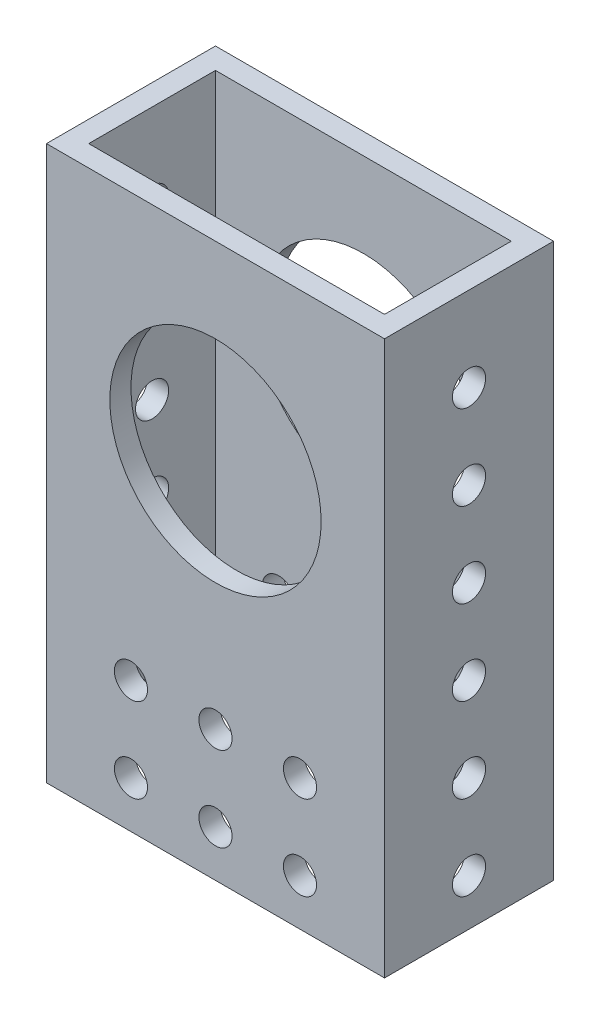
from build123d import *

# Parameters (mm, degrees)
SKETCH1_W           = 50.8
SKETCH1_H           = 225.425
SKETCH1_R           = 15.875
SKETCH1_R_2         = 2.4892
BOSS_EXTRUDE1_DEPTH = 25.4
SKETCH2_R           = 2.4892
CUT_EXTRUDE1_DEPTH  = 233.469848851
SKETCH3_W           = 44.45
SKETCH3_H           = 19.05
CUT_EXTRUDE2_DEPTH  = 233.469848884
SKETCH4_W           = 50.8
SKETCH4_H           = 142.24
CUT_EXTRUDE3_DEPTH  = 233.469848851


with BuildPart() as part:
    # Sketch1 → Boss-Extrude1 (new body)
    with BuildSketch(Plane.XY):
        with Locations((25.4, 112.7125)):
            Rectangle(SKETCH1_W, SKETCH1_H)
        with Locations((25.4, 196.85)):
            Circle(SKETCH1_R, mode=Mode.SUBTRACT)
        with Locations((25.4, 9.525)):
            Circle(SKETCH1_R_2, mode=Mode.SUBTRACT)
        with Locations((38.1, 9.525)):
            Circle(SKETCH1_R_2, mode=Mode.SUBTRACT)
        with Locations((12.7, 9.525)):
            Circle(SKETCH1_R_2, mode=Mode.SUBTRACT)
        with Locations((12.7, 22.225)):
            Circle(SKETCH1_R_2, mode=Mode.SUBTRACT)
        with Locations((25.4, 22.225)):
            Circle(SKETCH1_R_2, mode=Mode.SUBTRACT)
        with Locations((38.1, 22.225)):
            Circle(SKETCH1_R_2, mode=Mode.SUBTRACT)
        with Locations((12.7, 34.925)):
            Circle(SKETCH1_R_2, mode=Mode.SUBTRACT)
        with Locations((25.4, 34.925)):
            Circle(SKETCH1_R_2, mode=Mode.SUBTRACT)
        with Locations((38.1, 34.925)):
            Circle(SKETCH1_R_2, mode=Mode.SUBTRACT)
        with Locations((12.7, 85.725)):
            Circle(SKETCH1_R_2, mode=Mode.SUBTRACT)
        with Locations((25.4, 85.725)):
            Circle(SKETCH1_R_2, mode=Mode.SUBTRACT)
        with Locations((38.1, 85.725)):
            Circle(SKETCH1_R_2, mode=Mode.SUBTRACT)
        with Locations((12.7, 98.425)):
            Circle(SKETCH1_R_2, mode=Mode.SUBTRACT)
        with Locations((25.4, 98.425)):
            Circle(SKETCH1_R_2, mode=Mode.SUBTRACT)
        with Locations((38.1, 98.425)):
            Circle(SKETCH1_R_2, mode=Mode.SUBTRACT)
        with Locations((12.7, 149.225)):
            Circle(SKETCH1_R_2, mode=Mode.SUBTRACT)
        with Locations((25.4, 149.225)):
            Circle(SKETCH1_R_2, mode=Mode.SUBTRACT)
        with Locations((38.1, 149.225)):
            Circle(SKETCH1_R_2, mode=Mode.SUBTRACT)
        with Locations((12.7, 161.925)):
            Circle(SKETCH1_R_2, mode=Mode.SUBTRACT)
        with Locations((25.4, 161.925)):
            Circle(SKETCH1_R_2, mode=Mode.SUBTRACT)
        with Locations((38.1, 161.925)):
            Circle(SKETCH1_R_2, mode=Mode.SUBTRACT)
    extrude(amount=BOSS_EXTRUDE1_DEPTH)

    # Sketch2 → Cut-Extrude1 (cut, through all)
    with BuildSketch(Plane(origin=(50.8, 0, 0), x_dir=(0, 0, -1), z_dir=(1, 0, 0))):
        with Locations((-12.7, 9.525)):
            Circle(SKETCH2_R)
        with Locations((-12.7, 22.225)):
            Circle(SKETCH2_R)
        with Locations((-12.7, 34.925)):
            Circle(SKETCH2_R)
        with Locations((-12.7, 47.625)):
            Circle(SKETCH2_R)
        with Locations((-12.7, 60.325)):
            Circle(SKETCH2_R)
        with Locations((-12.7, 73.025)):
            Circle(SKETCH2_R)
        with Locations((-12.7, 85.725)):
            Circle(SKETCH2_R)
        with Locations((-12.7, 98.425)):
            Circle(SKETCH2_R)
        with Locations((-12.7, 111.125)):
            Circle(SKETCH2_R)
        with Locations((-12.7, 123.825)):
            Circle(SKETCH2_R)
        with Locations((-12.7, 136.525)):
            Circle(SKETCH2_R)
        with Locations((-12.7, 149.225)):
            Circle(SKETCH2_R)
        with Locations((-12.7, 161.925)):
            Circle(SKETCH2_R)
        with Locations((-12.7, 174.625)):
            Circle(SKETCH2_R)
        with Locations((-12.7, 187.325)):
            Circle(SKETCH2_R)
        with Locations((-12.7, 200.025)):
            Circle(SKETCH2_R)
        with Locations((-12.7, 212.725)):
            Circle(SKETCH2_R)
    extrude(amount=-CUT_EXTRUDE1_DEPTH, mode=Mode.SUBTRACT)

    # Sketch3 → Cut-Extrude2 (cut, through all)
    with BuildSketch(Plane(origin=(0, 225.425, 0), x_dir=(1, 0, 0), z_dir=(0, 1, 0))):
        with Locations((25.4, -12.7)):
            Rectangle(SKETCH3_W, SKETCH3_H)
    extrude(amount=-CUT_EXTRUDE2_DEPTH, mode=Mode.SUBTRACT)

    # Sketch4 → Cut-Extrude3 (cut, through all)
    with BuildSketch(Plane.XY.offset(25.4)):
        with Locations((25.4, 71.12)):
            Rectangle(SKETCH4_W, SKETCH4_H)
    extrude(amount=-CUT_EXTRUDE3_DEPTH, mode=Mode.SUBTRACT)


solid = part.part
